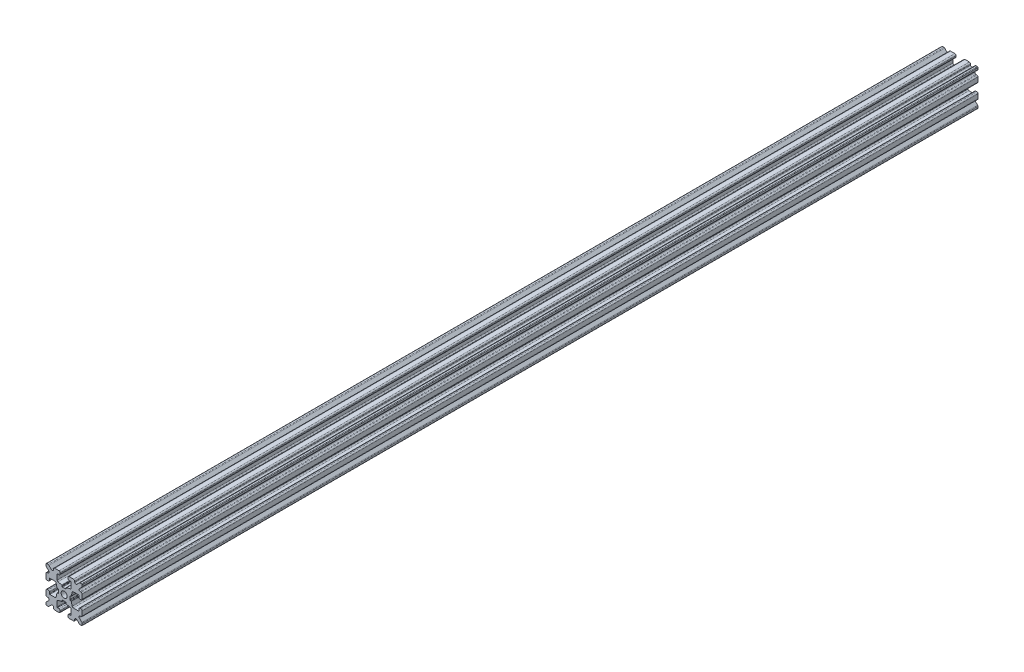
from build123d import *

# Parameters (mm, degrees)
SKETCH1_W           = 15
SKETCH1_H           = 15
SKETCH1_R           = 1.25
BOSS_EXTRUDE1_DEPTH = 185.5
FILLET1_R           = 0.25
CUT_EXTRUDE1_DEPTH  = 372.151586282
CUT_EXTRUDE3_DEPTH  = 372.151586282
FILLET3_R           = 0.5
FILLET4_R           = 0.5
FILLET5_R           = 3
FILLET6_R           = 0.2
CUT_EXTRUDE4_DEPTH  = 372.151586282
FILLET8_R           = 0.5
SKETCH6_W           = 5.1529354
SKETCH6_H           = 1.651
SKETCH6_W_2         = 1.651
SKETCH6_H_2         = 5.1529354
CUT_EXTRUDE5_DEPTH  = 372.151586282
FILLET10_R          = 0.2


with BuildPart() as part:
    # Sketch1 → Boss-Extrude1 (new, symmetric)
    with BuildSketch(Plane.XY):
        Rectangle(SKETCH1_W, SKETCH1_H)
        Circle(SKETCH1_R, mode=Mode.SUBTRACT)
    extrude(amount=BOSS_EXTRUDE1_DEPTH, both=True)

    # Fillet1
    fillet1_edges = [part.edges().sort_by_distance(p)[0] for p in [
        (7.5, -7.5, 0),
        (-7.5, -7.5, 0),
        (-7.5, 7.5, 0),
        (7.5, 7.5, 0),
    ]]
    fillet(fillet1_edges, radius=FILLET1_R)

    # Sketch2 → Cut-Extrude1 (cut, through all)
    with BuildSketch(Plane.XY.offset(185.5)):
        Polygon((-7.5, 1.6), (-6.1, 1.6), (-6.1, 2.9), (-3.4, 2.9), (-3.4, -2.9), (-6.1, -2.9), (-6.1, -1.6), (-7.5, -1.6), align=None)
        Polygon((2.9, 6.1), (1.6, 6.1), (1.6, 7.5), (-1.6, 7.5), (-1.6, 6.1), (-2.9, 6.1), (-2.9, 3.4), (2.9, 3.4), align=None)
        Polygon((-1.6, -7.5), (-1.6, -6.1), (-2.9, -6.1), (-2.9, -3.4), (2.9, -3.4), (2.9, -6.1), (1.6, -6.1), (1.6, -7.5), align=None)
        Polygon((6.1, -2.9), (6.1, -1.6), (7.5, -1.6), (7.5, 1.6), (6.1, 1.6), (6.1, 2.9), (3.4, 2.9), (3.4, -2.9), align=None)
    extrude(amount=-CUT_EXTRUDE1_DEPTH, mode=Mode.SUBTRACT)

    # Sketch4 → Cut-Extrude3 (cut, through all)
    with BuildSketch(Plane.XY.offset(185.5)):
        Polygon((-3.4, 2.9), (-2.75, 0), (-3.4, -2.9), align=None)
        Polygon((-2.9, 3.4), (0, 2.75), (2.9, 3.4), align=None)
        Polygon((3.4, 2.9), (2.75, 0), (3.4, -2.9), align=None)
        Polygon((-2.9, -3.4), (0, -2.75), (2.9, -3.4), align=None)
    extrude(amount=-CUT_EXTRUDE3_DEPTH, mode=Mode.SUBTRACT)

    # Fillet3
    fillet3_edges = [part.edges().sort_by_distance(p)[0] for p in [
        (1.6, -7.5, 0),
        (-1.6, -7.5, 0),
        (-1.6, -6.1, 0),
        (1.6, -6.1, 0),
        (6.1, 1.6, 0),
        (7.5, 1.6, 0),
        (7.5, -1.6, 0),
        (6.1, -1.6, 0),
        (-7.5, -1.6, 0),
        (-7.5, 1.6, 0),
        (-6.1, 1.6, 0),
        (-6.1, -1.6, 0),
        (-1.6, 6.1, 0),
        (-1.6, 7.5, 0),
        (1.6, 7.5, 0),
        (1.6, 6.1, 0),
    ]]
    fillet(fillet3_edges, radius=FILLET3_R)

    # Fillet4
    fillet4_edges = [part.edges().sort_by_distance(p)[0] for p in [
        (-2.9, -3.4, 0),
        (2.9, -3.4, 0),
        (3.4, -2.9, 0),
        (3.4, 2.9, 0),
        (-3.4, 2.9, 0),
        (-3.4, -2.9, 0),
        (2.9, 3.4, 0),
        (-2.9, 3.4, 0),
    ]]
    fillet(fillet4_edges, radius=FILLET4_R)

    # Fillet5
    fillet5_edges = [part.edges().sort_by_distance(p)[0] for p in [
        (-2.75, 0, 0),
        (0, 2.75, 0),
        (2.75, 0, 0),
        (0, -2.75, 0),
    ]]
    fillet(fillet5_edges, radius=FILLET5_R)

    # Fillet6
    fillet6_edges = [part.edges().sort_by_distance(p)[0] for p in [
        (-2.9, -6.1, 0),
        (2.9, -6.1, 0),
        (6.1, -2.9, 0),
        (6.1, 2.9, 0),
        (-6.1, 2.9, 0),
        (-6.1, -2.9, 0),
        (2.9, 6.1, 0),
        (-2.9, 6.1, 0),
    ]]
    fillet(fillet6_edges, radius=FILLET6_R)

    # Sketch5 → Cut-Extrude4 (cut, through all)
    with BuildSketch(Plane.XY.offset(185.5)):
        Polygon((-7.5, 6.439339828), (-5.460660172, 4.4), (-7.5, 4.4), align=None)
        Polygon((-6.439339828, 7.5), (-4.4, 5.460660172), (-4.4, 7.5), align=None)
        Polygon((4.4, 7.5), (6.439339828, 7.5), (4.4, 5.460660172), align=None)
        Polygon((7.5, 6.439339828), (7.5, 4.4), (5.460660172, 4.4), align=None)
        Polygon((7.5, -6.439339828), (5.460660172, -4.4), (7.5, -4.4), align=None)
        Polygon((6.439339828, -7.5), (4.4, -5.460660172), (4.4, -7.5), align=None)
        Polygon((-4.4, -7.5), (-6.439339828, -7.5), (-4.4, -5.460660172), align=None)
        Polygon((-7.5, -6.439339828), (-7.5, -4.4), (-5.460660172, -4.4), align=None)
    extrude(amount=-CUT_EXTRUDE4_DEPTH, mode=Mode.SUBTRACT)

    # Fillet8
    fillet8_edges = [part.edges().sort_by_distance(p)[0] for p in [
        (-7.5, 4.4, 0),
        (-7.5, 6.439339828, 0),
        (-5.460660172, 4.4, 0),
        (7.5, -4.4, 0),
        (7.5, -6.439339828, 0),
        (5.460660172, -4.4, 0),
        (5.460660172, 4.4, 0),
        (7.5, 6.439339828, 0),
        (7.5, 4.4, 0),
        (-4.4, 7.5, 0),
        (-4.4, 5.460660172, 0),
        (-6.439339828, 7.5, 0),
        (-5.460660172, -4.4, 0),
        (-7.5, -6.439339828, 0),
        (-7.5, -4.4, 0),
        (4.4, 5.460660172, 0),
        (4.4, 7.5, 0),
        (6.439339828, 7.5, 0),
        (6.439339828, -7.5, 0),
        (4.4, -7.5, 0),
        (4.4, -5.460660172, 0),
        (-6.439339828, -7.5, 0),
        (-4.4, -5.460660172, 0),
        (-4.4, -7.5, 0),
    ]]
    fillet(fillet8_edges, radius=FILLET8_R)

    # Sketch6 → Cut-Extrude5 (cut, through all)
    with BuildSketch(Plane.XY.offset(185.5)):
        with Locations((4.9235323, 0)):
            Rectangle(SKETCH6_W, SKETCH6_H)
        with Locations((0, -4.9235323)):
            Rectangle(SKETCH6_W_2, SKETCH6_H_2)
        with Locations((-4.9235323, 0)):
            Rectangle(SKETCH6_W, SKETCH6_H)
        with Locations((0, 4.9235323)):
            Rectangle(SKETCH6_W_2, SKETCH6_H_2)
    extrude(amount=-CUT_EXTRUDE5_DEPTH, mode=Mode.SUBTRACT)

    # Fillet10
    fillet10_edges = [part.edges().sort_by_distance(p)[0] for p in [
        (0.8255, -2.935025862, 0),
        (-0.8255, -2.935025862, 0),
        (0.8255, -2.3470646, 0),
        (-0.8255, -2.3470646, 0),
        (2.935025862, 0.8255, 0),
        (2.935025862, -0.8255, 0),
        (2.3470646, 0.8255, 0),
        (2.3470646, -0.8255, 0),
        (-2.935025862, -0.8255, 0),
        (-2.935025862, 0.8255, 0),
        (-2.3470646, -0.8255, 0),
        (-2.3470646, 0.8255, 0),
        (-0.8255, 2.935025862, 0),
        (0.8255, 2.935025862, 0),
        (-0.8255, 2.3470646, 0),
        (0.8255, 2.3470646, 0),
    ]]
    fillet(fillet10_edges, radius=FILLET10_R)


solid = part.part
